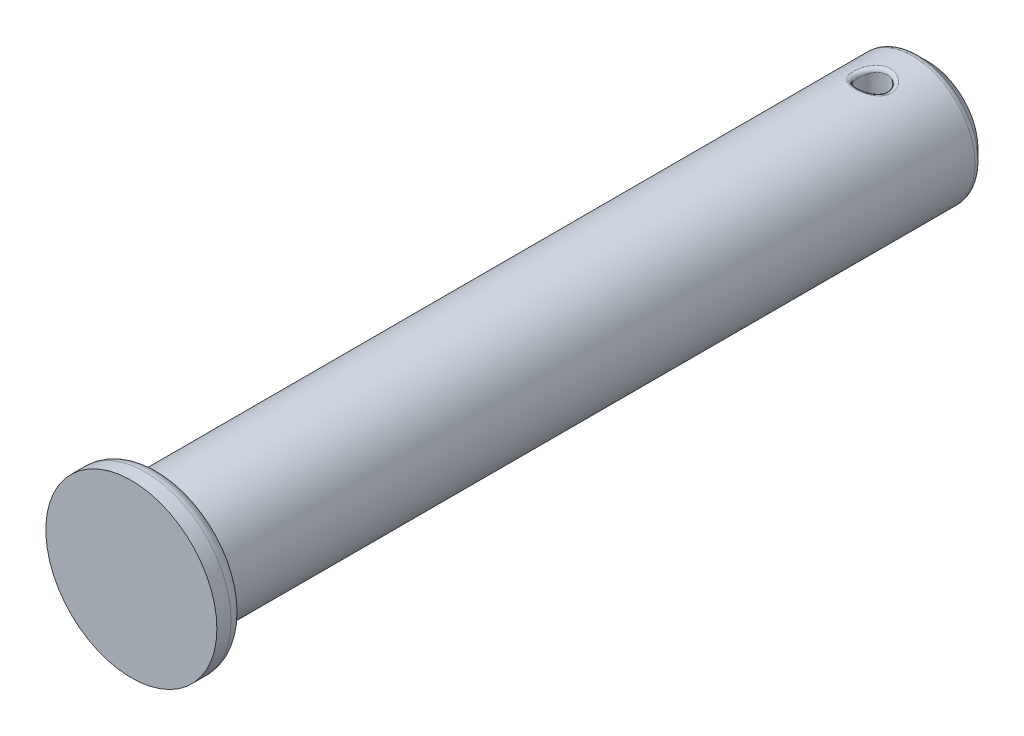
from build123d import *

# Parameters (mm, degrees)
SKETCH1_R               = 3.4925
BOSS_EXTRUDE1_DEPTH     = 42.8625
SKETCH2_R               = 4.7625
BOSS_EXTRUDE2_DEPTH     = 1.5875
CUT_EXTRUDE1_DEPTH      = 45.957372171
CUT_EXTRUDE1_DEPTH_BACK = 45.957372171
SKETCH3_R               = 0.79375
FILLET1_R               = 0.1984375
FILLET3_R               = 0.79375
CHAMFER1_SIZE           = 0.79375
FILLET4_R               = 0.396875


with BuildPart() as part:
    # Sketch1 → Boss-Extrude1 (new body)
    with BuildSketch(Plane.XY):
        Circle(SKETCH1_R)
    extrude(amount=BOSS_EXTRUDE1_DEPTH)

    # Sketch2 → Boss-Extrude2 (add)
    with BuildSketch(Plane.XY.offset(42.8625)):
        Circle(SKETCH2_R)
    extrude(amount=BOSS_EXTRUDE2_DEPTH)

    # Sketch3 → Cut-Extrude1 (cut, two sides: drawn at the far end of the back side and taken through both)
    with BuildSketch(Plane(origin=(0, 0, 0), x_dir=(1, 0, 0), z_dir=(0, 1, 0)).offset(-CUT_EXTRUDE1_DEPTH_BACK)):
        with Locations(Location((0, -3.175, 0), (0, 0, 270))):
            Circle(SKETCH3_R)
    extrude(amount=CUT_EXTRUDE1_DEPTH + CUT_EXTRUDE1_DEPTH_BACK, mode=Mode.SUBTRACT)

    # Fillet1
    fillet1_edges = [part.edges().sort_by_distance(p)[0] for p in [
        (0, 3.492500009, 2.38125001),
        (0, -3.4925, 2.38125),
    ]]
    fillet(fillet1_edges, radius=FILLET1_R)

    # Fillet3
    fillet3_edges = [part.edges().sort_by_distance(p)[0] for p in [
        (-4.7625, 0, 42.8625),
    ]]
    fillet(fillet3_edges, radius=FILLET3_R)

    # Chamfer1
    chamfer1_edges = [part.edges().sort_by_distance(p)[0] for p in [
        (-3.4925, 0, 0),
    ]]
    chamfer(chamfer1_edges, length=CHAMFER1_SIZE)

    # Fillet4
    fillet4_edges = [part.edges().sort_by_distance(p)[0] for p in [
        (-3.4925, 0, 0.79375),
        (-2.69875, 0, 0),
    ]]
    fillet(fillet4_edges, radius=FILLET4_R)


solid = part.part
